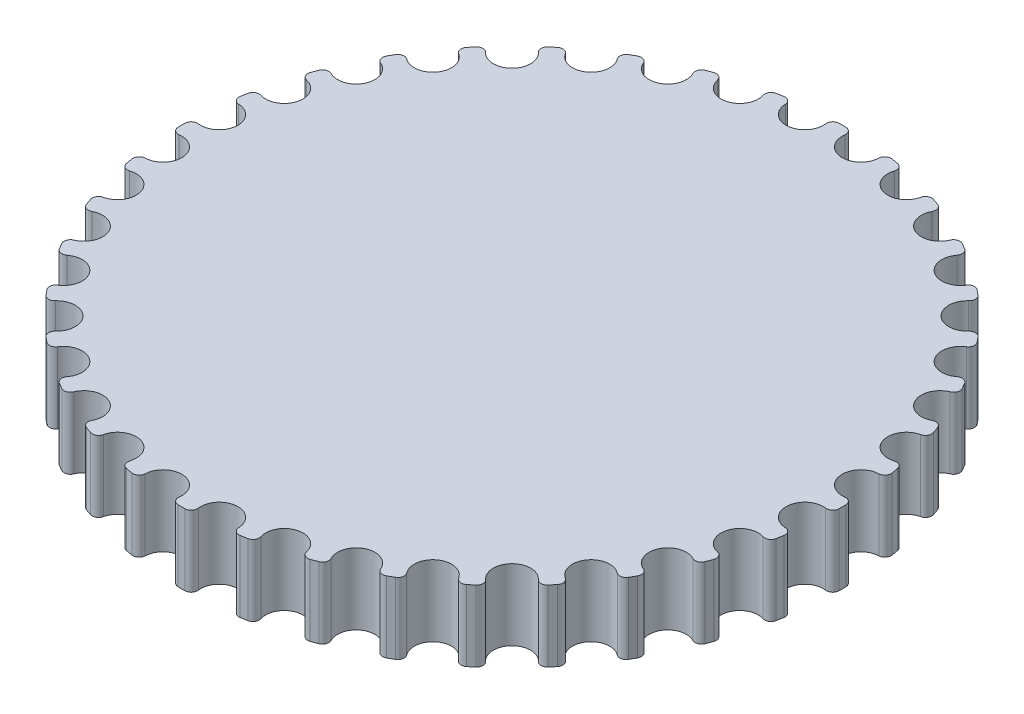
from build123d import *

# Parameters (mm, degrees)
BOSS_EXTRUDE1_DEPTH = 5.999999938


with BuildPart() as part:
    # Sketch1 → Boss-Extrude1 (new body)
    with BuildSketch(Plane(origin=(0, 0, 0), x_dir=(1, 0, 0), z_dir=(0, 1, 0))):
        with BuildLine():
            ThreePointArc((27.006809638, 3.941944521), (25.503221024, 2.231242723), (27.281026998, 0.807625752))
            ThreePointArc((27.281026998, 0.807625752), (27.701017668, 0.682149115), (27.885189098, 0.284383563))
            ThreePointArc((27.885189098, 0.284383563), (27.886276661, 0.14219363), (27.886639185, 0))
            ThreePointArc((27.886639185, 0), (27.886276661, -0.14219363), (27.885189098, -0.284383563))
            ThreePointArc((27.885189098, -0.284383563), (27.701017668, -0.682149115), (27.281026998, -0.807625752))
            ThreePointArc((27.281026998, -0.807625752), (25.503221024, -2.231242723), (27.006809638, -3.941944521))
            ThreePointArc((27.006809638, -3.941944521), (27.398630917, -4.1384455), (27.510933105, -4.562149133))
            ThreePointArc((27.510933105, -4.562149133), (27.487313123, -4.702367735), (27.462978475, -4.842464076))
            ThreePointArc((27.462978475, -4.842464076), (27.437929793, -4.982434513), (27.41216773, -5.122275409))
            ThreePointArc((27.41216773, -5.122275409), (27.161723015, -5.482016975), (26.726324158, -5.532656725))
            ThreePointArc((26.726324158, -5.532656725), (24.728318558, -6.625932988), (25.912004033, -8.571740804))
            ThreePointArc((25.912004033, -8.571740804), (26.263750629, -8.833295543), (26.300771331, -9.270063236))
            ThreePointArc((26.300771331, -9.270063236), (26.253161485, -9.404050035), (26.20486906, -9.537792331))
            ThreePointArc((26.20486906, -9.537792331), (26.155895313, -9.671286645), (26.106241517, -9.804529508))
            ThreePointArc((26.106241517, -9.804529508), (25.797133153, -10.115316523), (25.359555482, -10.089580724))
            ThreePointArc((25.359555482, -10.089580724), (23.202058646, -10.819297632), (24.029875298, -12.941089081))
            ThreePointArc((24.029875298, -12.941089081), (24.330859569, -13.259750371), (24.291473929, -13.696311159))
            ThreePointArc((24.291473929, -13.696311159), (24.22132082, -13.819995034), (24.15053796, -13.943319592))
            ThreePointArc((24.15053796, -13.943319592), (24.07912719, -14.066281626), (24.007090366, -14.188877939))
            ThreePointArc((24.007090366, -14.188877939), (23.648710454, -14.441267297), (23.222249545, -14.339937917))
            ThreePointArc((23.222249545, -14.339937917), (20.970815923, -14.683923392), (21.417610961, -16.917228914))
            ThreePointArc((21.417610961, -16.917228914), (21.658687653, -17.283314394), (21.544092384, -17.706403597))
            ThreePointArc((21.544092384, -17.706403597), (21.453527579, -17.816026477), (21.362404985, -17.925186144))
            ThreePointArc((21.362404985, -17.925186144), (21.270726971, -18.033879758), (21.178495923, -18.142104494))
            ThreePointArc((21.178495923, -18.142104494), (20.781733654, -18.328427472), (20.379347308, -18.154583353))
            ThreePointArc((20.379347308, -18.154583353), (18.10238557, -18.10238557), (18.154583353, -20.379347308))
            ThreePointArc((18.154583353, -20.379347308), (18.328427472, -20.781733654), (18.142104494, -21.178495923))
            ThreePointArc((18.142104494, -21.178495923), (18.033879758, -21.270726971), (17.925186144, -21.362404985))
            ThreePointArc((17.925186144, -21.362404985), (17.816026477, -21.453527579), (17.706403597, -21.544092384))
            ThreePointArc((17.706403597, -21.544092384), (17.283314394, -21.658687653), (16.917228914, -21.417610961))
            ThreePointArc((16.917228914, -21.417610961), (14.683923392, -20.970815923), (14.339937917, -23.222249545))
            ThreePointArc((14.339937917, -23.222249545), (14.441267297, -23.648710454), (14.188877939, -24.007090366))
            ThreePointArc((14.188877939, -24.007090366), (14.066281626, -24.07912719), (13.943319592, -24.15053796))
            ThreePointArc((13.943319592, -24.15053796), (13.819995034, -24.22132082), (13.696311159, -24.291473929))
            ThreePointArc((13.696311159, -24.291473929), (13.259750371, -24.330859569), (12.941089081, -24.029875298))
            ThreePointArc((12.941089081, -24.029875298), (10.819297632, -23.202058646), (10.089580724, -25.359555482))
            ThreePointArc((10.089580724, -25.359555482), (10.115316523, -25.797133153), (9.804529508, -26.106241517))
            ThreePointArc((9.804529508, -26.106241517), (9.671286645, -26.155895313), (9.537792331, -26.20486906))
            ThreePointArc((9.537792331, -26.20486906), (9.404050035, -26.253161485), (9.270063236, -26.300771331))
            ThreePointArc((9.270063236, -26.300771331), (8.833295543, -26.263750629), (8.571740804, -25.912004033))
            ThreePointArc((8.571740804, -25.912004033), (6.625932988, -24.728318558), (5.532656725, -26.726324158))
            ThreePointArc((5.532656725, -26.726324158), (5.482016975, -27.161723015), (5.122275409, -27.41216773))
            ThreePointArc((5.122275409, -27.41216773), (4.982434513, -27.437929793), (4.842464076, -27.462978475))
            ThreePointArc((4.842464076, -27.462978475), (4.702367735, -27.487313123), (4.562149133, -27.510933105))
            ThreePointArc((4.562149133, -27.510933105), (4.1384455, -27.398630917), (3.941944521, -27.006809638))
            ThreePointArc((3.941944521, -27.006809638), (2.231242723, -25.503221024), (0.807625752, -27.281026998))
            ThreePointArc((0.807625752, -27.281026998), (0.682149115, -27.701017668), (0.284383563, -27.885189098))
            ThreePointArc((0.284383563, -27.885189098), (0.14219363, -27.886276661), (0, -27.886639185))
            ThreePointArc((0, -27.886639185), (-0.14219363, -27.886276661), (-0.284383563, -27.885189098))
            ThreePointArc((-0.284383563, -27.885189098), (-0.682149115, -27.701017668), (-0.807625752, -27.281026998))
            ThreePointArc((-0.807625752, -27.281026998), (-2.231242723, -25.503221024), (-3.941944521, -27.006809638))
            ThreePointArc((-3.941944521, -27.006809638), (-4.1384455, -27.398630917), (-4.562149133, -27.510933105))
            ThreePointArc((-4.562149133, -27.510933105), (-4.702367735, -27.487313123), (-4.842464076, -27.462978475))
            ThreePointArc((-4.842464076, -27.462978475), (-4.982434513, -27.437929793), (-5.122275409, -27.41216773))
            ThreePointArc((-5.122275409, -27.41216773), (-5.482016975, -27.161723015), (-5.532656725, -26.726324158))
            ThreePointArc((-5.532656725, -26.726324158), (-6.625932988, -24.728318558), (-8.571740804, -25.912004033))
            ThreePointArc((-8.571740804, -25.912004033), (-8.833295543, -26.263750629), (-9.270063236, -26.300771331))
            ThreePointArc((-9.270063236, -26.300771331), (-9.404050035, -26.253161485), (-9.537792331, -26.20486906))
            ThreePointArc((-9.537792331, -26.20486906), (-9.671286645, -26.155895313), (-9.804529508, -26.106241517))
            ThreePointArc((-9.804529508, -26.106241517), (-10.115316523, -25.797133153), (-10.089580724, -25.359555482))
            ThreePointArc((-10.089580724, -25.359555482), (-10.819297632, -23.202058646), (-12.941089081, -24.029875298))
            ThreePointArc((-12.941089081, -24.029875298), (-13.259750371, -24.330859569), (-13.696311159, -24.291473929))
            ThreePointArc((-13.696311159, -24.291473929), (-13.819995034, -24.22132082), (-13.943319592, -24.15053796))
            ThreePointArc((-13.943319592, -24.15053796), (-14.066281626, -24.07912719), (-14.188877939, -24.007090366))
            ThreePointArc((-14.188877939, -24.007090366), (-14.441267297, -23.648710454), (-14.339937917, -23.222249545))
            ThreePointArc((-14.339937917, -23.222249545), (-14.683923392, -20.970815923), (-16.917228914, -21.417610961))
            ThreePointArc((-16.917228914, -21.417610961), (-17.283314394, -21.658687653), (-17.706403597, -21.544092384))
            ThreePointArc((-17.706403597, -21.544092384), (-17.816026477, -21.453527579), (-17.925186144, -21.362404985))
            ThreePointArc((-17.925186144, -21.362404985), (-18.033879758, -21.270726971), (-18.142104494, -21.178495923))
            ThreePointArc((-18.142104494, -21.178495923), (-18.328427472, -20.781733654), (-18.154583353, -20.379347308))
            ThreePointArc((-18.154583353, -20.379347308), (-18.10238557, -18.10238557), (-20.379347308, -18.154583353))
            ThreePointArc((-20.379347308, -18.154583353), (-20.781733654, -18.328427472), (-21.178495923, -18.142104494))
            ThreePointArc((-21.178495923, -18.142104494), (-21.270726971, -18.033879758), (-21.362404985, -17.925186144))
            ThreePointArc((-21.362404985, -17.925186144), (-21.453527579, -17.816026477), (-21.544092384, -17.706403597))
            ThreePointArc((-21.544092384, -17.706403597), (-21.658687653, -17.283314394), (-21.417610961, -16.917228914))
            ThreePointArc((-21.417610961, -16.917228914), (-20.970815923, -14.683923392), (-23.222249545, -14.339937917))
            ThreePointArc((-23.222249545, -14.339937917), (-23.648710454, -14.441267297), (-24.007090366, -14.188877939))
            ThreePointArc((-24.007090366, -14.188877939), (-24.07912719, -14.066281626), (-24.15053796, -13.943319592))
            ThreePointArc((-24.15053796, -13.943319592), (-24.22132082, -13.819995034), (-24.291473929, -13.696311159))
            ThreePointArc((-24.291473929, -13.696311159), (-24.330859569, -13.259750371), (-24.029875298, -12.941089081))
            ThreePointArc((-24.029875298, -12.941089081), (-23.202058646, -10.819297632), (-25.359555482, -10.089580724))
            ThreePointArc((-25.359555482, -10.089580724), (-25.797133153, -10.115316523), (-26.106241517, -9.804529508))
            ThreePointArc((-26.106241517, -9.804529508), (-26.155895313, -9.671286645), (-26.20486906, -9.537792331))
            ThreePointArc((-26.20486906, -9.537792331), (-26.253161485, -9.404050035), (-26.300771331, -9.270063236))
            ThreePointArc((-26.300771331, -9.270063236), (-26.263750629, -8.833295543), (-25.912004033, -8.571740804))
            ThreePointArc((-25.912004033, -8.571740804), (-24.728318558, -6.625932988), (-26.726324158, -5.532656725))
            ThreePointArc((-26.726324158, -5.532656725), (-27.161723015, -5.482016975), (-27.41216773, -5.122275409))
            ThreePointArc((-27.41216773, -5.122275409), (-27.437929793, -4.982434513), (-27.462978475, -4.842464076))
            ThreePointArc((-27.462978475, -4.842464076), (-27.487313123, -4.702367735), (-27.510933105, -4.562149133))
            ThreePointArc((-27.510933105, -4.562149133), (-27.398630917, -4.1384455), (-27.006809638, -3.941944521))
            ThreePointArc((-27.006809638, -3.941944521), (-25.503221024, -2.231242723), (-27.281026998, -0.807625752))
            ThreePointArc((-27.281026998, -0.807625752), (-27.701017668, -0.682149115), (-27.885189098, -0.284383563))
            ThreePointArc((-27.885189098, -0.284383563), (-27.886276661, -0.14219363), (-27.886639185, 0))
            ThreePointArc((-27.886639185, 0), (-27.886276661, 0.14219363), (-27.885189098, 0.284383563))
            ThreePointArc((-27.885189098, 0.284383563), (-27.701017668, 0.682149115), (-27.281026998, 0.807625752))
            ThreePointArc((-27.281026998, 0.807625752), (-25.503221024, 2.231242723), (-27.006809638, 3.941944521))
            ThreePointArc((-27.006809638, 3.941944521), (-27.398630917, 4.1384455), (-27.510933105, 4.562149133))
            ThreePointArc((-27.510933105, 4.562149133), (-27.487313123, 4.702367735), (-27.462978475, 4.842464076))
            ThreePointArc((-27.462978475, 4.842464076), (-27.437929793, 4.982434513), (-27.41216773, 5.122275409))
            ThreePointArc((-27.41216773, 5.122275409), (-27.161723015, 5.482016975), (-26.726324158, 5.532656725))
            ThreePointArc((-26.726324158, 5.532656725), (-24.728318558, 6.625932988), (-25.912004033, 8.571740804))
            ThreePointArc((-25.912004033, 8.571740804), (-26.263750629, 8.833295543), (-26.300771331, 9.270063236))
            ThreePointArc((-26.300771331, 9.270063236), (-26.253161485, 9.404050035), (-26.20486906, 9.537792331))
            ThreePointArc((-26.20486906, 9.537792331), (-26.155895313, 9.671286645), (-26.106241517, 9.804529508))
            ThreePointArc((-26.106241517, 9.804529508), (-25.797133153, 10.115316523), (-25.359555482, 10.089580724))
            ThreePointArc((-25.359555482, 10.089580724), (-23.202058646, 10.819297632), (-24.029875298, 12.941089081))
            ThreePointArc((-24.029875298, 12.941089081), (-24.330859569, 13.259750371), (-24.291473929, 13.696311159))
            ThreePointArc((-24.291473929, 13.696311159), (-24.22132082, 13.819995034), (-24.15053796, 13.943319592))
            ThreePointArc((-24.15053796, 13.943319592), (-24.07912719, 14.066281626), (-24.007090366, 14.188877939))
            ThreePointArc((-24.007090366, 14.188877939), (-23.648710454, 14.441267297), (-23.222249545, 14.339937917))
            ThreePointArc((-23.222249545, 14.339937917), (-20.970815923, 14.683923392), (-21.417610961, 16.917228914))
            ThreePointArc((-21.417610961, 16.917228914), (-21.658687653, 17.283314394), (-21.544092384, 17.706403597))
            ThreePointArc((-21.544092384, 17.706403597), (-21.453527579, 17.816026477), (-21.362404985, 17.925186144))
            ThreePointArc((-21.362404985, 17.925186144), (-21.270726971, 18.033879758), (-21.178495923, 18.142104494))
            ThreePointArc((-21.178495923, 18.142104494), (-20.781733654, 18.328427472), (-20.379347308, 18.154583353))
            ThreePointArc((-20.379347308, 18.154583353), (-18.10238557, 18.10238557), (-18.154583353, 20.379347308))
            ThreePointArc((-18.154583353, 20.379347308), (-18.328427472, 20.781733654), (-18.142104494, 21.178495923))
            ThreePointArc((-18.142104494, 21.178495923), (-18.033879758, 21.270726971), (-17.925186144, 21.362404985))
            ThreePointArc((-17.925186144, 21.362404985), (-17.816026477, 21.453527579), (-17.706403597, 21.544092384))
            ThreePointArc((-17.706403597, 21.544092384), (-17.283314394, 21.658687653), (-16.917228914, 21.417610961))
            ThreePointArc((-16.917228914, 21.417610961), (-14.683923392, 20.970815923), (-14.339937917, 23.222249545))
            ThreePointArc((-14.339937917, 23.222249545), (-14.441267297, 23.648710454), (-14.188877939, 24.007090366))
            ThreePointArc((-14.188877939, 24.007090366), (-14.066281626, 24.07912719), (-13.943319592, 24.15053796))
            ThreePointArc((-13.943319592, 24.15053796), (-13.819995034, 24.22132082), (-13.696311159, 24.291473929))
            ThreePointArc((-13.696311159, 24.291473929), (-13.259750371, 24.330859569), (-12.941089081, 24.029875298))
            ThreePointArc((-12.941089081, 24.029875298), (-10.819297632, 23.202058646), (-10.089580724, 25.359555482))
            ThreePointArc((-10.089580724, 25.359555482), (-10.115316523, 25.797133153), (-9.804529508, 26.106241517))
            ThreePointArc((-9.804529508, 26.106241517), (-9.671286645, 26.155895313), (-9.537792331, 26.20486906))
            ThreePointArc((-9.537792331, 26.20486906), (-9.404050035, 26.253161485), (-9.270063236, 26.300771331))
            ThreePointArc((-9.270063236, 26.300771331), (-8.833295543, 26.263750629), (-8.571740804, 25.912004033))
            ThreePointArc((-8.571740804, 25.912004033), (-6.625932988, 24.728318558), (-5.532656725, 26.726324158))
            ThreePointArc((-5.532656725, 26.726324158), (-5.482016975, 27.161723015), (-5.122275409, 27.41216773))
            ThreePointArc((-5.122275409, 27.41216773), (-4.982434513, 27.437929793), (-4.842464076, 27.462978475))
            ThreePointArc((-4.842464076, 27.462978475), (-4.702367735, 27.487313123), (-4.562149133, 27.510933105))
            ThreePointArc((-4.562149133, 27.510933105), (-4.1384455, 27.398630917), (-3.941944521, 27.006809638))
            ThreePointArc((-3.941944521, 27.006809638), (-2.231242723, 25.503221024), (-0.807625752, 27.281026998))
            ThreePointArc((-0.807625752, 27.281026998), (-0.682149115, 27.701017668), (-0.284383563, 27.885189098))
            ThreePointArc((-0.284383563, 27.885189098), (-0.14219363, 27.886276661), (0, 27.886639185))
            ThreePointArc((0, 27.886639185), (0.14219363, 27.886276661), (0.284383563, 27.885189098))
            ThreePointArc((0.284383563, 27.885189098), (0.682149115, 27.701017668), (0.807625752, 27.281026998))
            ThreePointArc((0.807625752, 27.281026998), (2.231242723, 25.503221024), (3.941944521, 27.006809638))
            ThreePointArc((3.941944521, 27.006809638), (4.1384455, 27.398630917), (4.562149133, 27.510933105))
            ThreePointArc((4.562149133, 27.510933105), (4.702367735, 27.487313123), (4.842464076, 27.462978475))
            ThreePointArc((4.842464076, 27.462978475), (4.982434513, 27.437929793), (5.122275409, 27.41216773))
            ThreePointArc((5.122275409, 27.41216773), (5.482016975, 27.161723015), (5.532656725, 26.726324158))
            ThreePointArc((5.532656725, 26.726324158), (6.625932988, 24.728318558), (8.571740804, 25.912004033))
            ThreePointArc((8.571740804, 25.912004033), (8.833295543, 26.263750629), (9.270063236, 26.300771331))
            ThreePointArc((9.270063236, 26.300771331), (9.404050035, 26.253161485), (9.537792331, 26.20486906))
            ThreePointArc((9.537792331, 26.20486906), (9.671286645, 26.155895313), (9.804529508, 26.106241517))
            ThreePointArc((9.804529508, 26.106241517), (10.115316523, 25.797133153), (10.089580724, 25.359555482))
            ThreePointArc((10.089580724, 25.359555482), (10.819297632, 23.202058646), (12.941089081, 24.029875298))
            ThreePointArc((12.941089081, 24.029875298), (13.259750371, 24.330859569), (13.696311159, 24.291473929))
            ThreePointArc((13.696311159, 24.291473929), (13.819995034, 24.22132082), (13.943319592, 24.15053796))
            ThreePointArc((13.943319592, 24.15053796), (14.066281626, 24.07912719), (14.188877939, 24.007090366))
            ThreePointArc((14.188877939, 24.007090366), (14.441267297, 23.648710454), (14.339937917, 23.222249545))
            ThreePointArc((14.339937917, 23.222249545), (14.683923392, 20.970815923), (16.917228914, 21.417610961))
            ThreePointArc((16.917228914, 21.417610961), (17.283314394, 21.658687653), (17.706403597, 21.544092384))
            ThreePointArc((17.706403597, 21.544092384), (17.816026477, 21.453527579), (17.925186144, 21.362404985))
            ThreePointArc((17.925186144, 21.362404985), (18.033879758, 21.270726971), (18.142104494, 21.178495923))
            ThreePointArc((18.142104494, 21.178495923), (18.328427472, 20.781733654), (18.154583353, 20.379347308))
            ThreePointArc((18.154583353, 20.379347308), (18.10238557, 18.10238557), (20.379347308, 18.154583353))
            ThreePointArc((20.379347308, 18.154583353), (20.781733654, 18.328427472), (21.178495923, 18.142104494))
            ThreePointArc((21.178495923, 18.142104494), (21.270726971, 18.033879758), (21.362404985, 17.925186144))
            ThreePointArc((21.362404985, 17.925186144), (21.453527579, 17.816026477), (21.544092384, 17.706403597))
            ThreePointArc((21.544092384, 17.706403597), (21.658687653, 17.283314394), (21.417610961, 16.917228914))
            ThreePointArc((21.417610961, 16.917228914), (20.970815923, 14.683923392), (23.222249545, 14.339937917))
            ThreePointArc((23.222249545, 14.339937917), (23.648710454, 14.441267297), (24.007090366, 14.188877939))
            ThreePointArc((24.007090366, 14.188877939), (24.07912719, 14.066281626), (24.15053796, 13.943319592))
            ThreePointArc((24.15053796, 13.943319592), (24.22132082, 13.819995034), (24.291473929, 13.696311159))
            ThreePointArc((24.291473929, 13.696311159), (24.330859569, 13.259750371), (24.029875298, 12.941089081))
            ThreePointArc((24.029875298, 12.941089081), (23.202058646, 10.819297632), (25.359555482, 10.089580724))
            ThreePointArc((25.359555482, 10.089580724), (25.797133153, 10.115316523), (26.106241517, 9.804529508))
            ThreePointArc((26.106241517, 9.804529508), (26.155895313, 9.671286645), (26.20486906, 9.537792331))
            ThreePointArc((26.20486906, 9.537792331), (26.253161485, 9.404050035), (26.300771331, 9.270063236))
            ThreePointArc((26.300771331, 9.270063236), (26.263750629, 8.833295543), (25.912004033, 8.571740804))
            ThreePointArc((25.912004033, 8.571740804), (24.728318558, 6.625932988), (26.726324158, 5.532656725))
            ThreePointArc((26.726324158, 5.532656725), (27.161723015, 5.482016975), (27.41216773, 5.122275409))
            ThreePointArc((27.41216773, 5.122275409), (27.437929793, 4.982434513), (27.462978475, 4.842464076))
            ThreePointArc((27.462978475, 4.842464076), (27.487313123, 4.702367735), (27.510933105, 4.562149133))
            ThreePointArc((27.510933105, 4.562149133), (27.398630917, 4.1384455), (27.006809638, 3.941944521))
        make_face()
    extrude(amount=BOSS_EXTRUDE1_DEPTH)


solid = part.part
